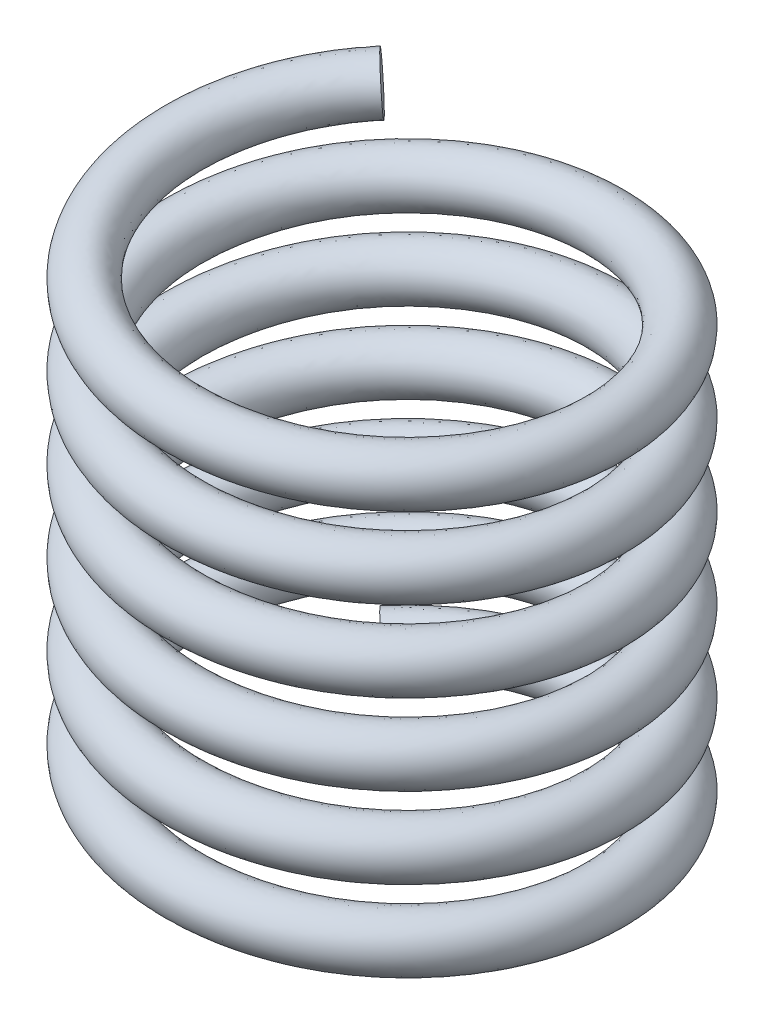
from build123d import *

# Parameters (mm, degrees)
SWEEP1_PITCH       = 0.766666667
SWEEP1_HEIGHT      = 4.6
SWEEP1_RADIUS      = 2
SWEEP1_START_ANGLE = -135
SKETCH3_R          = 0.25


with BuildPart() as part:
    # Sweep1: sweep along a helix
    with BuildLine() as sweep1_path:
        add(Helix(SWEEP1_PITCH, SWEEP1_HEIGHT, SWEEP1_RADIUS, center=(0, 0, 0), direction=(0, 1, 0), lefthand=True, mode=Mode.PRIVATE).rotate(Axis((0, 0, 0), (0, 1, 0)), SWEEP1_START_ANGLE))
    # Sketch3 → Sweep1 (sweep)
    with BuildSketch(Plane(origin=(-1.414213562, 0, -1.414213562), x_dir=(-0.7084166652698817, 0.06067076116785465, -0.7031819729680318), z_dir=(0.7057944660932817, 0.06089616789406294, -0.7057944660932938))):
        with Locations((-0.000722946, -0.000119939)):
            Circle(SKETCH3_R)
    sweep(path=sweep1_path.line, is_frenet=True)


solid = part.part
